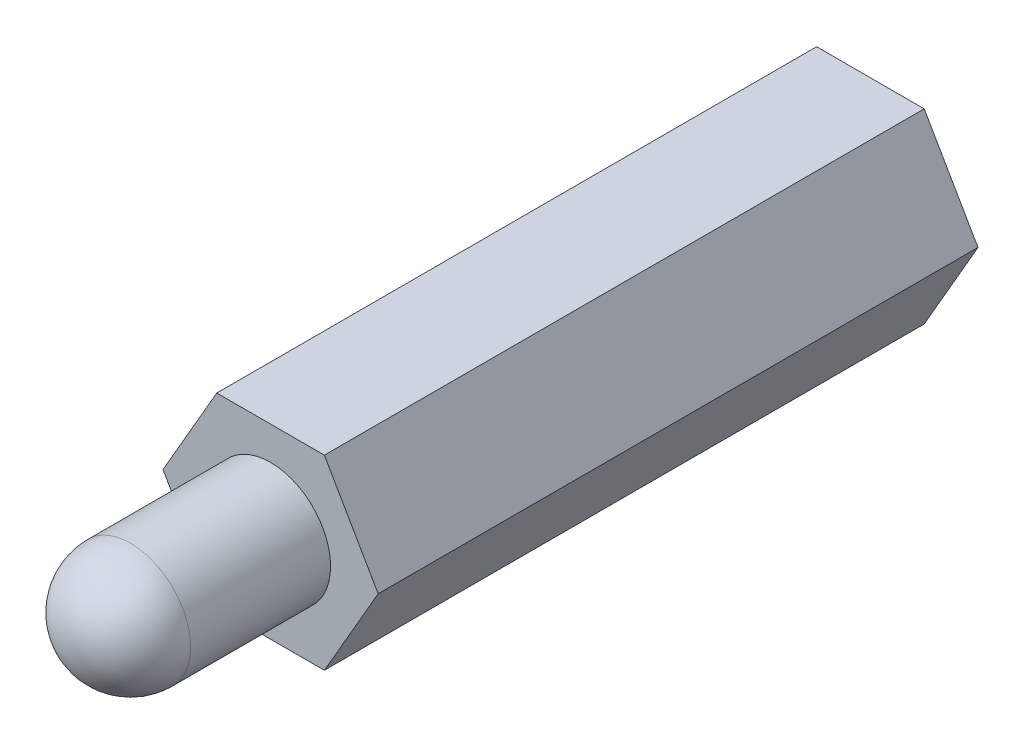
from build123d import *

# Parameters (mm, degrees)
EXTRUDE_1_DEPTH     = 15
SKETCH_2_R          = 1.5
EXTRUDE_2_DEPTH     = 5
FILLET_1_R          = 1.5
SKETCH_3_R          = 1.25
CUT_EXTRUDE_1_DEPTH = 10


with BuildPart() as part:
    # 草图1 → 凸台-拉伸1 (new body)
    with BuildSketch(Plane.XY):
        Polygon((2.690452254, 0), (1.345226127, 2.33), (-1.345226127, 2.33), (-2.690452254, 0), (-1.345226127, -2.33), (1.345226127, -2.33), align=None)
    extrude(amount=EXTRUDE_1_DEPTH)

    # 草图2 → 凸台-拉伸2 (add)
    with BuildSketch(Plane.XY.offset(15)):
        Circle(SKETCH_2_R)
    extrude(amount=EXTRUDE_2_DEPTH)

    # 圆角1
    fillet_1_edges = [part.edges().sort_by_distance(p)[0] for p in [
        (-1.5, 0, 20),
    ]]
    fillet(fillet_1_edges, radius=FILLET_1_R)

    # 草图3 → 切除-拉伸1 (cut)
    with BuildSketch(Plane(origin=(0, 0, 0), x_dir=(-1, 0, 0), z_dir=(0, 0, -1))):
        Circle(SKETCH_3_R)
    extrude(amount=-CUT_EXTRUDE_1_DEPTH, mode=Mode.SUBTRACT)


solid = part.part
